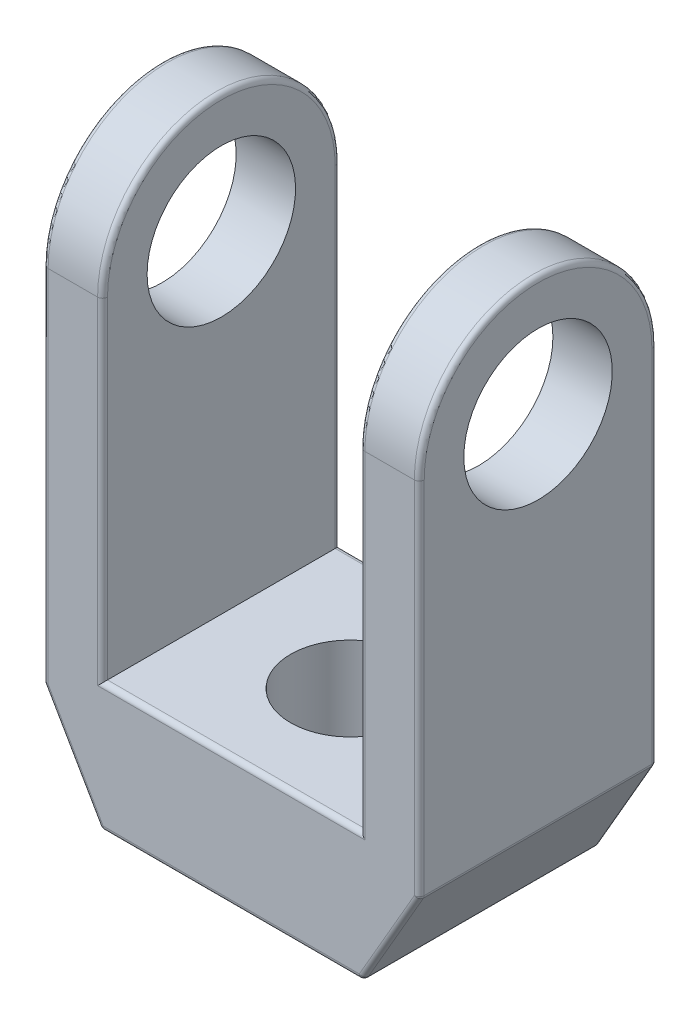
from build123d import *

# Parameters (mm, degrees)
BOSS_EXTRUDE1_DEPTH = 24
SKETCH2_W           = 52
SKETCH2_H           = 93
CUT_EXTRUDE1_DEPTH  = 48
CUT_EXTRUDE2_DEPTH  = 105
SKETCH4_R           = 15
CUT_EXTRUDE3_DEPTH  = 105
SKETCH5_R           = 12
CUT_EXTRUDE4_DEPTH  = 105
FILLET1_R           = 1


with BuildPart() as part:
    # Sketch1 → Boss-Extrude1 (new, symmetric)
    with BuildSketch(Plane.XY):
        Polygon((-38, -49.5), (-26.452994616, -69.5), (26.452994616, -69.5), (38, -49.5), (38, 49.5), (-38, 49.5), align=None)
    extrude(amount=BOSS_EXTRUDE1_DEPTH, both=True)

    # Sketch2 → Cut-Extrude1 (cut)
    with BuildSketch(Plane.XY.offset(24)):
        with Locations((0, 3)):
            Rectangle(SKETCH2_W, SKETCH2_H)
    extrude(amount=-CUT_EXTRUDE1_DEPTH, mode=Mode.SUBTRACT)

    # Sketch3 → Cut-Extrude2 (cut)
    with BuildSketch(Plane.ZY.offset(38)):
        with BuildLine():
            Line((-24, 23.5), (-24, 49.5))
            Line((-24, 49.5), (24, 49.5))
            Line((24, 49.5), (24, 23.5))
            ThreePointArc((24, 23.5), (0, 47.5), (-24, 23.5))
        make_face()
    extrude(amount=-CUT_EXTRUDE2_DEPTH, mode=Mode.SUBTRACT)

    # Sketch4 → Cut-Extrude3 (cut)
    with BuildSketch(Plane.ZY.offset(38)):
        with Locations((0, 23.5)):
            Circle(SKETCH4_R)
    extrude(amount=-CUT_EXTRUDE3_DEPTH, mode=Mode.SUBTRACT)

    # Sketch5 → Cut-Extrude4 (cut)
    with BuildSketch(Plane(origin=(0, -43.5, 0), x_dir=(1, 0, 0), z_dir=(0, 1, 0))):
        with Locations(Location((0, 0, 0), (0, 0, 270))):
            Circle(SKETCH5_R)
    extrude(amount=-CUT_EXTRUDE4_DEPTH, mode=Mode.SUBTRACT)

    # Fillet1
    fillet1_edges = [part.edges().sort_by_distance(p)[0] for p in [
        (38, -49.5, 0),
        (26.452994616, -69.5, 0),
        (-26.452994616, -69.5, 0),
        (-38, -49.5, 0),
        (-32.226497308, -59.5, 24),
        (0, -69.5, 24),
        (32.226497308, -59.5, 24),
        (26, -10, -24),
        (0, -43.5, -24),
        (0, -43.5, 24),
        (26, -10, 24),
        (-26, -10, 24),
        (-26, -10, -24),
        (-26, 47.5, 0),
        (-38, -13, -24),
        (-38, -13, 24),
        (38, 47.5, 0),
        (26, 47.5, 0),
        (38, -13, 24),
        (-38, 47.5, 0),
        (32.226497308, -59.5, -24),
        (0, -69.5, -24),
        (-32.226497308, -59.5, -24),
        (0, -69.5, -12),
        (38, -13, -24),
    ]]
    fillet(fillet1_edges, radius=FILLET1_R)


solid = part.part
